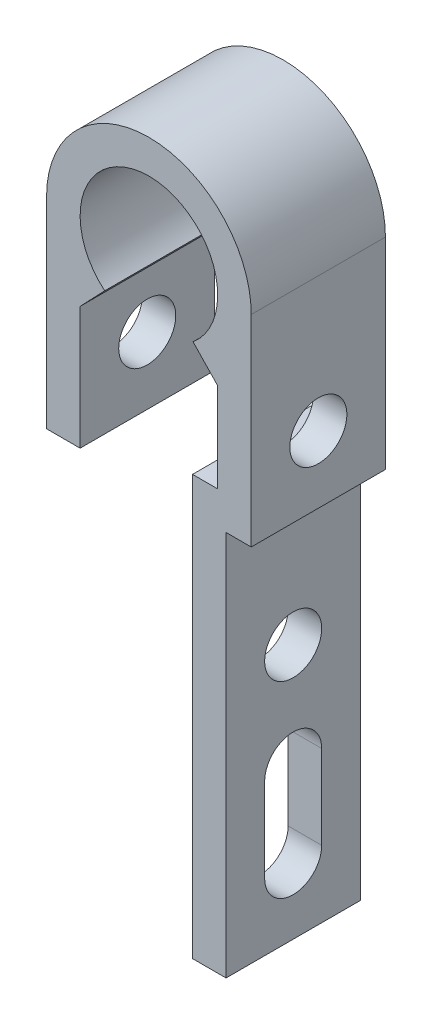
from build123d import *

# Parameters (mm, degrees)
RESSALTO_EXTRUS_O1_DEPTH = 8
ESBO_O2_R                = 1.7
CORTE_EXTRUS_O1_DEPTH    = 38.918860742


with BuildPart() as part:
    # Esboço1 → Ressalto-extrusão1 (new body)
    with BuildSketch(Plane.XY):
        with BuildLine():
            Line((4.1, -4.676945082), (2.6354292, -3.140782217))
            ThreePointArc((2.6354292, -3.140782217), (0, 4.1), (-2.6354292, -3.140782217))
            Line((-2.6354292, -3.140782217), (-4.1, -4.676945082))
            Line((-4.1, -4.676945082), (-4.1, -12))
            Line((-4.1, -12), (-6.1, -12))
            Line((-6.1, -12), (-6.1, 0))
            ThreePointArc((-6.1, 0), (0, 6.1), (6.1, 0))
            Line((6.1, 0), (6.1, -12))
            Line((6.1, -12), (4.6, -12))
            Line((4.6, -12), (4.6, -35))
            Line((4.6, -35), (2.6, -35))
            Line((2.6, -35), (2.6, -10))
            Line((2.6, -10), (4.1, -10))
            Line((4.1, -10), (4.1, -4.676945082))
        make_face()
    extrude(amount=RESSALTO_EXTRUS_O1_DEPTH)

    # Esboço2 → Corte-extrusão1 (cut, through all)
    with BuildSketch(Plane.ZY.offset(6.1)):
        with Locations((4, -8)):
            Circle(ESBO_O2_R)
        with Locations(Location((4, -19.8, 0), (0, 0, 270))):
            Circle(ESBO_O2_R)
        with BuildLine():
            Line((5.7, -26), (5.7, -31))
            ThreePointArc((5.7, -31), (4, -32.7), (2.3, -31))
            Line((2.3, -31), (2.3, -26))
            ThreePointArc((2.3, -26), (4, -24.3), (5.7, -26))
        make_face()
    extrude(amount=-CORTE_EXTRUS_O1_DEPTH, mode=Mode.SUBTRACT)


solid = part.part
